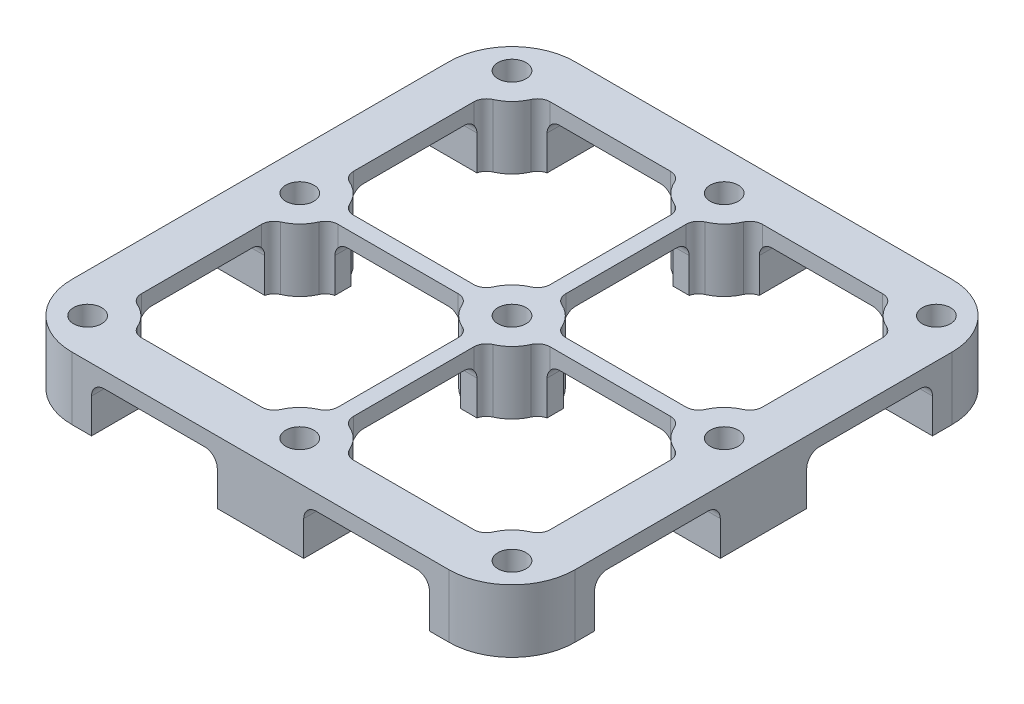
from build123d import *

# Parameters (mm, degrees)
SKETCH1_R           = 2.839062822
BOSS_EXTRUDE1_DEPTH = 12.7
CUT_EXTRUDE1_DEPTH  = 145.244271983
CUT_EXTRUDE2_DEPTH  = 145.244272063


with BuildPart() as part:
    # Sketch1 → Boss-Extrude1 (new body)
    with BuildSketch(Plane(origin=(0, 0, 0), x_dir=(1, 0, 0), z_dir=(0, 1, 0))):
        with BuildLine():
            Line((12.7, 0), (88.9, 0))
            ThreePointArc((88.9, 0), (97.880256121, 3.719743879), (101.6, 12.7))
            Line((101.6, 12.7), (101.6, 88.9))
            ThreePointArc((101.6, 88.9), (97.880256121, 97.880256121), (88.9, 101.6))
            Line((88.9, 101.6), (12.7, 101.6))
            ThreePointArc((12.7, 101.6), (3.719743879, 97.880256121), (0, 88.9))
            Line((0, 88.9), (0, 12.7))
            ThreePointArc((0, 12.7), (3.719743879, 3.719743879), (12.7, 0))
        make_face()
        with Locations(Location((7.9375, 93.6625, 0), (0, 0, 270))):
            Circle(SKETCH1_R, mode=Mode.SUBTRACT)
        with Locations(Location((50.8, 93.6625, 0), (0, 0, 270))):
            Circle(SKETCH1_R, mode=Mode.SUBTRACT)
        with Locations(Location((93.6625, 93.6625, 0), (0, 0, 270))):
            Circle(SKETCH1_R, mode=Mode.SUBTRACT)
        with Locations(Location((50.8, 50.8, 0), (0, 0, 270))):
            Circle(SKETCH1_R, mode=Mode.SUBTRACT)
        with Locations(Location((93.6625, 50.8, 0), (0, 0, 270))):
            Circle(SKETCH1_R, mode=Mode.SUBTRACT)
        with Locations(Location((50.8, 7.9375, 0), (0, 0, 270))):
            Circle(SKETCH1_R, mode=Mode.SUBTRACT)
        with Locations(Location((93.6625, 7.9375, 0), (0, 0, 270))):
            Circle(SKETCH1_R, mode=Mode.SUBTRACT)
        with Locations(Location((7.9375, 50.8, 0), (0, 0, 270))):
            Circle(SKETCH1_R, mode=Mode.SUBTRACT)
        with Locations(Location((7.9375, 7.9375, 0), (0, 0, 270))):
            Circle(SKETCH1_R, mode=Mode.SUBTRACT)
        with BuildLine():
            Line((17.221321613, 52.3875), (41.516178387, 52.3875))
            ThreePointArc((41.516178387, 52.3875), (42.900128801, 52.797645251), (43.83713379, 53.895625))
            ThreePointArc((43.83713379, 53.895625), (45.411846327, 56.188153673), (47.704375, 57.76286621))
            ThreePointArc((47.704375, 57.76286621), (48.802354749, 58.699871199), (49.2125, 60.083821613))
            Line((49.2125, 60.083821613), (49.2125, 84.378678387))
            ThreePointArc((49.2125, 84.378678387), (48.802354749, 85.762628801), (47.704375, 86.69963379))
            ThreePointArc((47.704375, 86.69963379), (45.411846327, 88.274346327), (43.83713379, 90.566875))
            ThreePointArc((43.83713379, 90.566875), (42.900128801, 91.664854749), (41.516178387, 92.075))
            Line((41.516178387, 92.075), (17.221321613, 92.075))
            ThreePointArc((17.221321613, 92.075), (15.837371199, 91.664854749), (14.90036621, 90.566875))
            ThreePointArc((14.90036621, 90.566875), (13.325653673, 88.274346327), (11.033125, 86.69963379))
            ThreePointArc((11.033125, 86.69963379), (9.935145251, 85.762628801), (9.525, 84.378678387))
            Line((9.525, 84.378678387), (9.525, 60.083821613))
            ThreePointArc((9.525, 60.083821613), (9.935145251, 58.699871199), (11.033125, 57.76286621))
            ThreePointArc((11.033125, 57.76286621), (13.325653673, 56.188153673), (14.90036621, 53.895625))
            ThreePointArc((14.90036621, 53.895625), (15.837371199, 52.797645251), (17.221321613, 52.3875))
        make_face(mode=Mode.SUBTRACT)
        with BuildLine():
            Line((92.075, 84.378678387), (92.075, 60.083821613))
            ThreePointArc((92.075, 60.083821613), (91.664854749, 58.699871199), (90.566875, 57.76286621))
            ThreePointArc((90.566875, 57.76286621), (88.274346327, 56.188153673), (86.69963379, 53.895625))
            ThreePointArc((86.69963379, 53.895625), (85.762628801, 52.797645251), (84.378678387, 52.3875))
            Line((84.378678387, 52.3875), (60.083821613, 52.3875))
            ThreePointArc((60.083821613, 52.3875), (58.699871199, 52.797645251), (57.76286621, 53.895625))
            ThreePointArc((57.76286621, 53.895625), (56.188153673, 56.188153673), (53.895625, 57.76286621))
            ThreePointArc((53.895625, 57.76286621), (52.797645251, 58.699871199), (52.3875, 60.083821613))
            Line((52.3875, 60.083821613), (52.3875, 84.378678387))
            ThreePointArc((52.3875, 84.378678387), (52.797645251, 85.762628801), (53.895625, 86.69963379))
            ThreePointArc((53.895625, 86.69963379), (56.188153673, 88.274346327), (57.76286621, 90.566875))
            ThreePointArc((57.76286621, 90.566875), (58.699871199, 91.664854749), (60.083821613, 92.075))
            Line((60.083821613, 92.075), (84.378678387, 92.075))
            ThreePointArc((84.378678387, 92.075), (85.762628801, 91.664854749), (86.69963379, 90.566875))
            ThreePointArc((86.69963379, 90.566875), (88.274346327, 88.274346327), (90.566875, 86.69963379))
            ThreePointArc((90.566875, 86.69963379), (91.664854749, 85.762628801), (92.075, 84.378678387))
        make_face(mode=Mode.SUBTRACT)
        with BuildLine():
            Line((52.3875, 17.221321613), (52.3875, 41.516178387))
            ThreePointArc((52.3875, 41.516178387), (52.797645251, 42.900128801), (53.895625, 43.83713379))
            ThreePointArc((53.895625, 43.83713379), (56.188153673, 45.411846327), (57.76286621, 47.704375))
            ThreePointArc((57.76286621, 47.704375), (58.699871199, 48.802354749), (60.083821613, 49.2125))
            Line((60.083821613, 49.2125), (84.378678387, 49.2125))
            ThreePointArc((84.378678387, 49.2125), (85.762628801, 48.802354749), (86.69963379, 47.704375))
            ThreePointArc((86.69963379, 47.704375), (88.274346327, 45.411846327), (90.566875, 43.83713379))
            ThreePointArc((90.566875, 43.83713379), (91.664854749, 42.900128801), (92.075, 41.516178387))
            Line((92.075, 41.516178387), (92.075, 17.221321613))
            ThreePointArc((92.075, 17.221321613), (91.664854749, 15.837371199), (90.566875, 14.90036621))
            ThreePointArc((90.566875, 14.90036621), (88.274346327, 13.325653673), (86.69963379, 11.033125))
            ThreePointArc((86.69963379, 11.033125), (85.762628801, 9.935145251), (84.378678387, 9.525))
            Line((84.378678387, 9.525), (60.083821613, 9.525))
            ThreePointArc((60.083821613, 9.525), (58.699871199, 9.935145251), (57.76286621, 11.033125))
            ThreePointArc((57.76286621, 11.033125), (56.188153673, 13.325653673), (53.895625, 14.90036621))
            ThreePointArc((53.895625, 14.90036621), (52.797645251, 15.837371199), (52.3875, 17.221321613))
        make_face(mode=Mode.SUBTRACT)
        with BuildLine():
            Line((9.525, 17.221321613), (9.525, 41.516178387))
            ThreePointArc((9.525, 41.516178387), (9.935145251, 42.900128801), (11.033125, 43.83713379))
            ThreePointArc((11.033125, 43.83713379), (13.325653673, 45.411846327), (14.90036621, 47.704375))
            ThreePointArc((14.90036621, 47.704375), (15.837371199, 48.802354749), (17.221321613, 49.2125))
            Line((17.221321613, 49.2125), (41.516178387, 49.2125))
            ThreePointArc((41.516178387, 49.2125), (42.900128801, 48.802354749), (43.83713379, 47.704375))
            ThreePointArc((43.83713379, 47.704375), (45.411846327, 45.411846327), (47.704375, 43.83713379))
            ThreePointArc((47.704375, 43.83713379), (48.802354749, 42.900128801), (49.2125, 41.516178387))
            Line((49.2125, 41.516178387), (49.2125, 17.221321613))
            ThreePointArc((49.2125, 17.221321613), (48.802354749, 15.837371199), (47.704375, 14.90036621))
            ThreePointArc((47.704375, 14.90036621), (45.411846327, 13.325653673), (43.83713379, 11.033125))
            ThreePointArc((43.83713379, 11.033125), (42.900128801, 9.935145251), (41.516178387, 9.525))
            Line((41.516178387, 9.525), (17.221321613, 9.525))
            ThreePointArc((17.221321613, 9.525), (15.837371199, 9.935145251), (14.90036621, 11.033125))
            ThreePointArc((14.90036621, 11.033125), (13.325653673, 13.325653673), (11.033125, 14.90036621))
            ThreePointArc((11.033125, 14.90036621), (9.935145251, 15.837371199), (9.525, 17.221321613))
        make_face(mode=Mode.SUBTRACT)
    extrude(amount=BOSS_EXTRUDE1_DEPTH)

    # Sketch2 → Cut-Extrude1 (cut, through all)
    with BuildSketch(Plane.XY):
        with BuildLine():
            Line((16.66875, 0), (42.06875, 0))
            Line((42.06875, 0), (42.06875, 6.985))
            ThreePointArc((42.06875, 6.985), (41.324801224, 8.781051224), (39.52875, 9.525))
            Line((39.52875, 9.525), (19.20875, 9.525))
            ThreePointArc((19.20875, 9.525), (17.412698776, 8.781051224), (16.66875, 6.985))
            Line((16.66875, 6.985), (16.66875, 0))
        make_face()
        with BuildLine():
            Line((59.53125, 0), (84.93125, 0))
            Line((84.93125, 0), (84.93125, 6.985))
            ThreePointArc((84.93125, 6.985), (84.187301224, 8.781051224), (82.39125, 9.525))
            Line((82.39125, 9.525), (62.07125, 9.525))
            ThreePointArc((62.07125, 9.525), (60.275198776, 8.781051224), (59.53125, 6.985))
            Line((59.53125, 6.985), (59.53125, 0))
        make_face()
    extrude(amount=-CUT_EXTRUDE1_DEPTH, mode=Mode.SUBTRACT)

    # Sketch3 → Cut-Extrude2 (cut, through all)
    with BuildSketch(Plane.ZY):
        with BuildLine():
            Line((-84.93125, 0), (-59.53125, 0))
            Line((-59.53125, 0), (-59.53125, 6.985))
            ThreePointArc((-59.53125, 6.985), (-60.275198776, 8.781051224), (-62.07125, 9.525))
            Line((-62.07125, 9.525), (-82.39125, 9.525))
            ThreePointArc((-82.39125, 9.525), (-84.187301224, 8.781051224), (-84.93125, 6.985))
            Line((-84.93125, 6.985), (-84.93125, 0))
        make_face()
        with BuildLine():
            Line((-16.66875, 0), (-42.06875, 0))
            Line((-42.06875, 0), (-42.06875, 6.985))
            ThreePointArc((-42.06875, 6.985), (-41.324801224, 8.781051224), (-39.52875, 9.525))
            Line((-39.52875, 9.525), (-19.20875, 9.525))
            ThreePointArc((-19.20875, 9.525), (-17.412698776, 8.781051224), (-16.66875, 6.985))
            Line((-16.66875, 6.985), (-16.66875, 0))
        make_face()
    extrude(amount=-CUT_EXTRUDE2_DEPTH, mode=Mode.SUBTRACT)


solid = part.part
